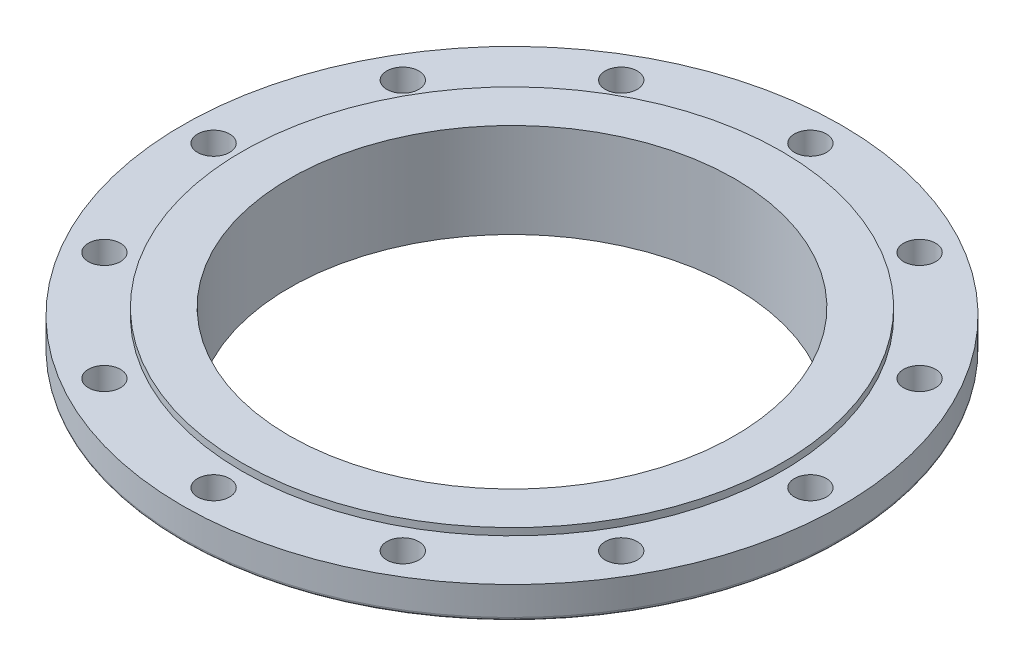
from build123d import *

# Parameters (mm, degrees)
SKETCH_2_R          = 9
CUT_EXTRUDE_1_DEPTH = 267.178511668


with BuildPart() as part:
    # Эскиз1 → Повернуть1 (revolve)
    with BuildSketch(Plane.XY, mode=Mode.PRIVATE) as revolve_1_sk:
        with BuildLine():
            Line((-125, 0), (-125, 53))
            Line((-125, 53), (-151.5, 53))
            Line((-151.5, 53), (-151.5, 49))
            Line((-151.5, 49), (-185, 49))
            Line((-185, 49), (-185, 33))
            ThreePointArc((-185, 33), (-184.414213562, 31.585786438), (-183, 31))
            Line((-183, 31), (-149.961434147, 31))
            ThreePointArc((-149.961434147, 31), (-145.422843479, 29.329277132), (-143.050746302, 25.114627072))
            Line((-143.050746302, 25.114627072), (-139, 0))
            Line((-139, 0), (-125, 0))
        make_face()
    revolve(revolve_1_sk.sketch.rotate(Axis((0, 0, 0), (0, 1, 0)), 270), axis=Axis((0, 0, 0), (0, 1, 0)))

    # Эскиз2 → Вырез-Вытянуть1 (cut, through all)
    with BuildSketch(Plane(origin=(0, 49, 0), x_dir=(1, 0, 0), z_dir=(0, 1, 0))):
        with Locations(Location((-167.5, 0, 0), (0, 0, 270))):
            Circle(SKETCH_2_R)
        with Locations(Location((-145.059255134, 83.75, 0), (0, 0, 270))):
            Circle(SKETCH_2_R)
        with Locations(Location((-83.75, 145.059255134, 0), (0, 0, 270))):
            Circle(SKETCH_2_R)
        with Locations(Location((0, 167.5, 0), (0, 0, 270))):
            Circle(SKETCH_2_R)
        with Locations(Location((83.75, 145.059255134, 0), (0, 0, 270))):
            Circle(SKETCH_2_R)
        with Locations(Location((145.059255134, 83.75, 0), (0, 0, 270))):
            Circle(SKETCH_2_R)
        with Locations(Location((167.5, 0, 0), (0, 0, 270))):
            Circle(SKETCH_2_R)
        with Locations(Location((145.059255134, -83.75, 0), (0, 0, 270))):
            Circle(SKETCH_2_R)
        with Locations(Location((83.75, -145.059255134, 0), (0, 0, 270))):
            Circle(SKETCH_2_R)
        with Locations(Location((0, -167.5, 0), (0, 0, 270))):
            Circle(SKETCH_2_R)
        with Locations(Location((-83.75, -145.059255134, 0), (0, 0, 270))):
            Circle(SKETCH_2_R)
        with Locations(Location((-145.059255134, -83.75, 0), (0, 0, 270))):
            Circle(SKETCH_2_R)
    extrude(amount=-CUT_EXTRUDE_1_DEPTH, mode=Mode.SUBTRACT)


solid = part.part
